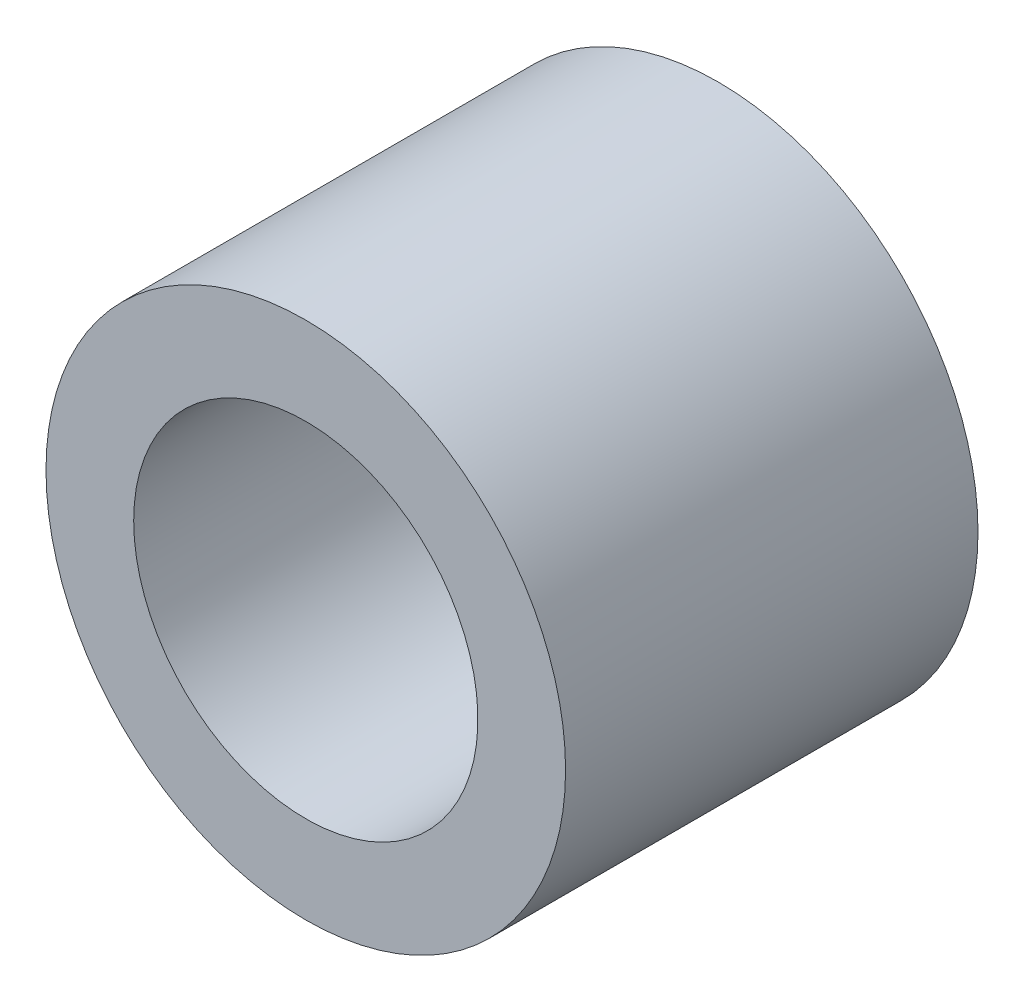
from build123d import *

# Parameters (mm, degrees)
SKETCH1_W = 1.35
SKETCH1_H = 6.35


with BuildPart() as part:
    # Sketch1 → Revolve1 (revolve)
    with BuildSketch(Plane.XZ, mode=Mode.PRIVATE) as revolve1_sk:
        with Locations((3.325, 0)):
            Rectangle(SKETCH1_W, SKETCH1_H)
    revolve(revolve1_sk.sketch.rotate(Axis((0, 0, 3.175), (0, 0, -1)), 180), axis=Axis((0, 0, 3.175), (0, 0, -1)))


solid = part.part
